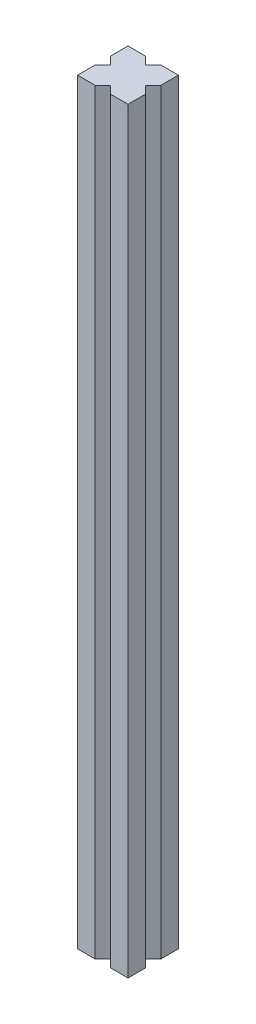
from build123d import *

# Parameters (mm, degrees)
SKIZZE1_W                       = 20
SKIZZE1_H                       = 20
AUFSATZ_LINEAR_AUSTRAGEN1_DEPTH = 300
SCHNITT_LINEAR_AUSTRAGEN1_DEPTH = 302.330383466


with BuildPart() as part:
    # Skizze1 → Aufsatz-Linear austragen1 (new body)
    with BuildSketch(Plane(origin=(0, 0, 0), x_dir=(1, 0, 0), z_dir=(0, 1, 0))):
        with Locations((10, 10)):
            Rectangle(SKIZZE1_W, SKIZZE1_H)
    extrude(amount=AUFSATZ_LINEAR_AUSTRAGEN1_DEPTH)

    # Skizze2 → Schnitt-Linear austragen1 (cut, through all)
    with BuildSketch(Plane(origin=(0, 300, 0), x_dir=(1, 0, 0), z_dir=(0, 1, 0))):
        Polygon((7, 20), (10, 17), (13, 20), align=None)
        Polygon((20, 13), (17, 10), (20, 7), align=None)
        Polygon((0, 7), (0, 13), (3, 10), align=None)
        Polygon((7, 0), (13, 0), (10, 3), align=None)
    extrude(amount=-SCHNITT_LINEAR_AUSTRAGEN1_DEPTH, mode=Mode.SUBTRACT)


solid = part.part
